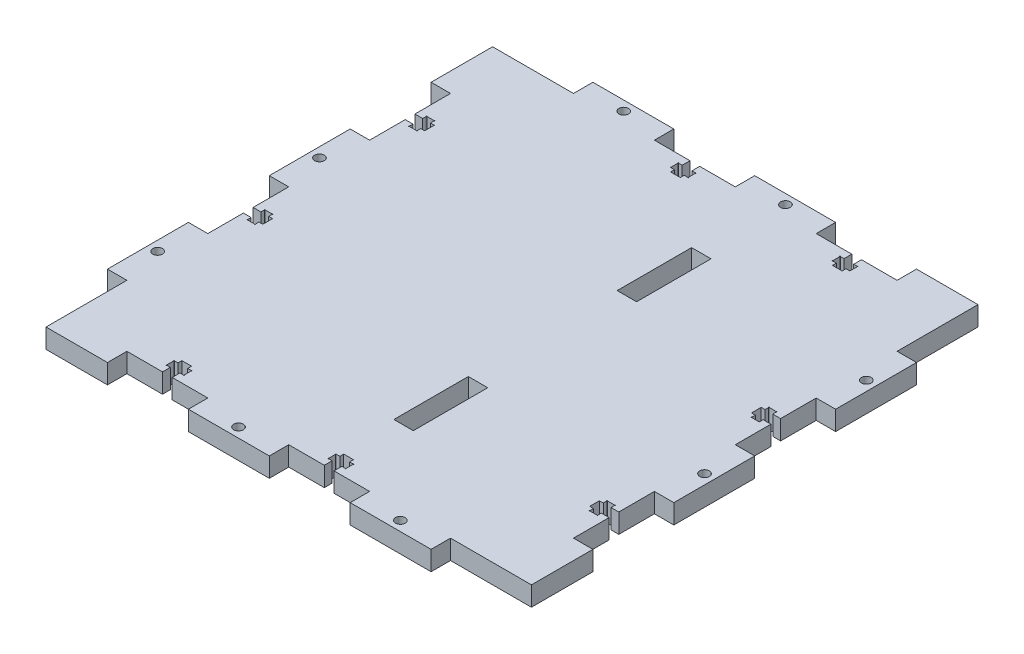
from build123d import *

# Parameters (mm, degrees)
BOSS_EXTRUDE1_DEPTH = 6
SKETCH2_R           = 1.5
CUT_EXTRUDE1_DEPTH  = 107.235587258
SKETCH3_W           = 6
SKETCH3_H           = 23
CUT_EXTRUDE2_DEPTH  = 107.235587258


with BuildPart() as part:
    # Sketch1 → Boss-Extrude1 (new body)
    with BuildSketch(Plane(origin=(0, 0, 0), x_dir=(1, 0, 0), z_dir=(0, 1, 0))):
        Polygon((0, 75), (25, 75), (25, 69), (50, 69), (50, 75), (69, 75), (69, 50), (75, 50), (75, 25), (69, 25), (69, 0), (75, 0), (75, -25), (69, -25), (69, -50), (75, -50), (75, -69), (50, -69), (50, -75), (25, -75), (25, -69), (0, -69), (0, -75), (-25, -75), (-25, -69), (-50, -69), (-50, -75), (-69, -75), (-69, -50), (-75, -50), (-75, -25), (-69, -25), (-69, 0), (-75, 0), (-75, 25), (-69, 25), (-69, 50), (-75, 50), (-75, 69), (-50, 69), (-50, 75), (-25, 75), (-25, 69), (0, 69), align=None)
    extrude(amount=BOSS_EXTRUDE1_DEPTH)

    # Sketch2 → Cut-Extrude1 (cut, through all)
    with BuildSketch(Plane(origin=(0, 6, 0), x_dir=(1, 0, 0), z_dir=(0, 1, 0))):
        with Locations(Location((-37.5, 72, 0), (0, 0, 270))):
            Circle(SKETCH2_R)
        with Locations(Location((12.5, 72, 0), (0, 0, 270))):
            Circle(SKETCH2_R)
        with Locations(Location((72, 37.5, 0), (0, 0, 270))):
            Circle(SKETCH2_R)
        with Locations(Location((72, -12.5, 0), (0, 0, 270))):
            Circle(SKETCH2_R)
        with Locations(Location((37.5, -72, 0), (0, 0, 270))):
            Circle(SKETCH2_R)
        with Locations(Location((-12.5, -72, 0), (0, 0, 270))):
            Circle(SKETCH2_R)
        with Locations(Location((-72, -37.5, 0), (0, 0, 270))):
            Circle(SKETCH2_R)
        with Locations(Location((-72, 12.5, 0), (0, 0, 270))):
            Circle(SKETCH2_R)
        with BuildLine():
            Line((-11, 69), (-14, 69))
            Line((-14, 69), (-14, 66.6))
            Line((-14, 66.6), (-15.1, 66.6))
            ThreePointArc((-15.1, 66.6), (-15.270710678, 66.670710678), (-15.2, 66.5))
            Line((-15.2, 66.5), (-15.2, 64.3))
            ThreePointArc((-15.2, 64.3), (-15.270710678, 64.129289322), (-15.1, 64.2))
            Line((-15.1, 64.2), (-14, 64.2))
            Line((-14, 64.2), (-14, 63))
            Line((-14, 63), (-11, 63))
            Line((-11, 63), (-11, 64.2))
            Line((-11, 64.2), (-9.9, 64.2))
            ThreePointArc((-9.9, 64.2), (-9.729289322, 64.129289322), (-9.8, 64.3))
            Line((-9.8, 64.3), (-9.8, 66.5))
            ThreePointArc((-9.8, 66.5), (-9.729289322, 66.670710678), (-9.9, 66.6))
            Line((-9.9, 66.6), (-11, 66.6))
            Line((-11, 66.6), (-11, 69))
        make_face()
        with BuildLine():
            Line((69, 11), (69, 14))
            Line((69, 14), (66.6, 14))
            Line((66.6, 14), (66.6, 15.1))
            ThreePointArc((66.6, 15.1), (66.670710678, 15.270710678), (66.5, 15.2))
            Line((66.5, 15.2), (64.3, 15.2))
            ThreePointArc((64.3, 15.2), (64.129289322, 15.270710678), (64.2, 15.1))
            Line((64.2, 15.1), (64.2, 14))
            Line((64.2, 14), (63, 14))
            Line((63, 14), (63, 11))
            Line((63, 11), (64.2, 11))
            Line((64.2, 11), (64.2, 9.9))
            ThreePointArc((64.2, 9.9), (64.129289322, 9.729289322), (64.3, 9.8))
            Line((64.3, 9.8), (66.5, 9.8))
            ThreePointArc((66.5, 9.8), (66.670710678, 9.729289322), (66.6, 9.9))
            Line((66.6, 9.9), (66.6, 11))
            Line((66.6, 11), (69, 11))
        make_face()
        with BuildLine():
            Line((39, 69), (36, 69))
            Line((36, 69), (36, 66.6))
            Line((36, 66.6), (34.9, 66.6))
            ThreePointArc((34.9, 66.6), (34.729289322, 66.670710678), (34.8, 66.5))
            Line((34.8, 66.5), (34.8, 64.3))
            ThreePointArc((34.8, 64.3), (34.729289322, 64.129289322), (34.9, 64.2))
            Line((34.9, 64.2), (36, 64.2))
            Line((36, 64.2), (36, 63))
            Line((36, 63), (39, 63))
            Line((39, 63), (39, 64.2))
            Line((39, 64.2), (40.1, 64.2))
            ThreePointArc((40.1, 64.2), (40.270710678, 64.129289322), (40.2, 64.3))
            Line((40.2, 64.3), (40.2, 66.5))
            ThreePointArc((40.2, 66.5), (40.270710678, 66.670710678), (40.1, 66.6))
            Line((40.1, 66.6), (39, 66.6))
            Line((39, 66.6), (39, 69))
        make_face()
        with BuildLine():
            Line((69, -39), (69, -36))
            Line((69, -36), (66.6, -36))
            Line((66.6, -36), (66.6, -34.9))
            ThreePointArc((66.6, -34.9), (66.670710678, -34.729289322), (66.5, -34.8))
            Line((66.5, -34.8), (64.3, -34.8))
            ThreePointArc((64.3, -34.8), (64.129289322, -34.729289322), (64.2, -34.9))
            Line((64.2, -34.9), (64.2, -36))
            Line((64.2, -36), (63, -36))
            Line((63, -36), (63, -39))
            Line((63, -39), (64.2, -39))
            Line((64.2, -39), (64.2, -40.1))
            ThreePointArc((64.2, -40.1), (64.129289322, -40.270710678), (64.3, -40.2))
            Line((64.3, -40.2), (66.5, -40.2))
            ThreePointArc((66.5, -40.2), (66.670710678, -40.270710678), (66.6, -40.1))
            Line((66.6, -40.1), (66.6, -39))
            Line((66.6, -39), (69, -39))
        make_face()
        with BuildLine():
            Line((11, -69), (14, -69))
            Line((14, -69), (14, -66.6))
            Line((14, -66.6), (15.1, -66.6))
            ThreePointArc((15.1, -66.6), (15.270710678, -66.670710678), (15.2, -66.5))
            Line((15.2, -66.5), (15.2, -64.3))
            ThreePointArc((15.2, -64.3), (15.270710678, -64.129289322), (15.1, -64.2))
            Line((15.1, -64.2), (14, -64.2))
            Line((14, -64.2), (14, -63))
            Line((14, -63), (11, -63))
            Line((11, -63), (11, -64.2))
            Line((11, -64.2), (9.9, -64.2))
            ThreePointArc((9.9, -64.2), (9.729289322, -64.129289322), (9.8, -64.3))
            Line((9.8, -64.3), (9.8, -66.5))
            ThreePointArc((9.8, -66.5), (9.729289322, -66.670710678), (9.9, -66.6))
            Line((9.9, -66.6), (11, -66.6))
            Line((11, -66.6), (11, -69))
        make_face()
        with BuildLine():
            Line((-39, -69), (-36, -69))
            Line((-36, -69), (-36, -66.6))
            Line((-36, -66.6), (-34.9, -66.6))
            ThreePointArc((-34.9, -66.6), (-34.729289322, -66.670710678), (-34.8, -66.5))
            Line((-34.8, -66.5), (-34.8, -64.3))
            ThreePointArc((-34.8, -64.3), (-34.729289322, -64.129289322), (-34.9, -64.2))
            Line((-34.9, -64.2), (-36, -64.2))
            Line((-36, -64.2), (-36, -63))
            Line((-36, -63), (-39, -63))
            Line((-39, -63), (-39, -64.2))
            Line((-39, -64.2), (-40.1, -64.2))
            ThreePointArc((-40.1, -64.2), (-40.270710678, -64.129289322), (-40.2, -64.3))
            Line((-40.2, -64.3), (-40.2, -66.5))
            ThreePointArc((-40.2, -66.5), (-40.270710678, -66.670710678), (-40.1, -66.6))
            Line((-40.1, -66.6), (-39, -66.6))
            Line((-39, -66.6), (-39, -69))
        make_face()
        with BuildLine():
            Line((-69, 39), (-69, 36))
            Line((-69, 36), (-66.6, 36))
            Line((-66.6, 36), (-66.6, 34.9))
            ThreePointArc((-66.6, 34.9), (-66.670710678, 34.729289322), (-66.5, 34.8))
            Line((-66.5, 34.8), (-64.3, 34.8))
            ThreePointArc((-64.3, 34.8), (-64.129289322, 34.729289322), (-64.2, 34.9))
            Line((-64.2, 34.9), (-64.2, 36))
            Line((-64.2, 36), (-63, 36))
            Line((-63, 36), (-63, 39))
            Line((-63, 39), (-64.2, 39))
            Line((-64.2, 39), (-64.2, 40.1))
            ThreePointArc((-64.2, 40.1), (-64.129289322, 40.270710678), (-64.3, 40.2))
            Line((-64.3, 40.2), (-66.5, 40.2))
            ThreePointArc((-66.5, 40.2), (-66.670710678, 40.270710678), (-66.6, 40.1))
            Line((-66.6, 40.1), (-66.6, 39))
            Line((-66.6, 39), (-69, 39))
        make_face()
        with BuildLine():
            Line((-69, -11), (-69, -14))
            Line((-69, -14), (-66.6, -14))
            Line((-66.6, -14), (-66.6, -15.1))
            ThreePointArc((-66.6, -15.1), (-66.670710678, -15.270710678), (-66.5, -15.2))
            Line((-66.5, -15.2), (-64.3, -15.2))
            ThreePointArc((-64.3, -15.2), (-64.129289322, -15.270710678), (-64.2, -15.1))
            Line((-64.2, -15.1), (-64.2, -14))
            Line((-64.2, -14), (-63, -14))
            Line((-63, -14), (-63, -11))
            Line((-63, -11), (-64.2, -11))
            Line((-64.2, -11), (-64.2, -9.9))
            ThreePointArc((-64.2, -9.9), (-64.129289322, -9.729289322), (-64.3, -9.8))
            Line((-64.3, -9.8), (-66.5, -9.8))
            ThreePointArc((-66.5, -9.8), (-66.670710678, -9.729289322), (-66.6, -9.9))
            Line((-66.6, -9.9), (-66.6, -11))
            Line((-66.6, -11), (-69, -11))
        make_face()
    extrude(amount=-CUT_EXTRUDE1_DEPTH, mode=Mode.SUBTRACT)

    # Sketch3 → Cut-Extrude2 (cut, through all)
    with BuildSketch(Plane.XZ):
        with Locations((12.5, 34.5)):
            Rectangle(SKETCH3_W, SKETCH3_H)
        with Locations((12.5, -34.5)):
            Rectangle(SKETCH3_W, SKETCH3_H)
    extrude(amount=-CUT_EXTRUDE2_DEPTH, mode=Mode.SUBTRACT)


solid = part.part
